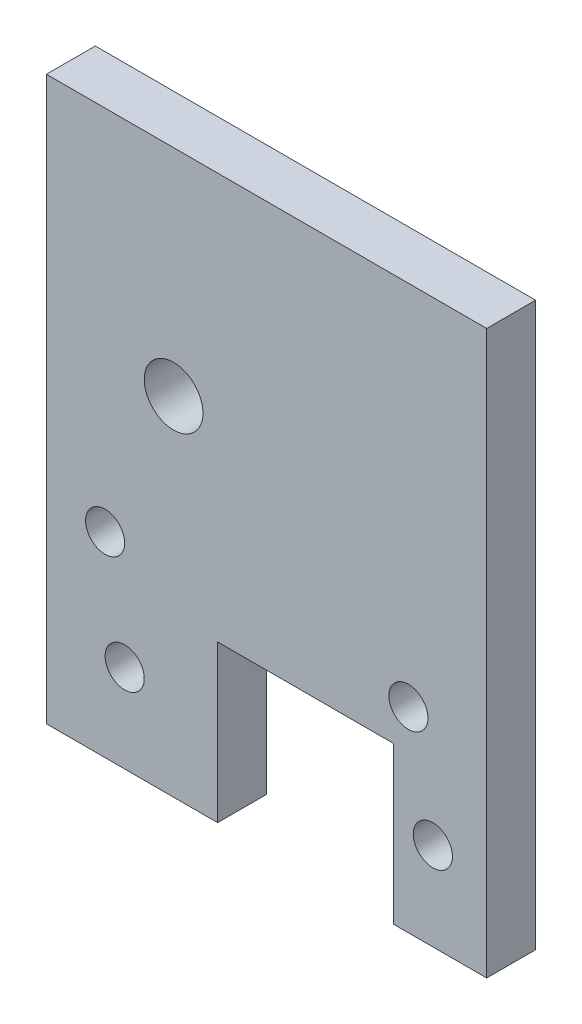
from build123d import *

# Parameters (mm, degrees)
SKETCH2_R           = 2
SKETCH2_R_2         = 3
BOSS_EXTRUDE1_DEPTH = 5


with BuildPart() as part:
    # Sketch2 → Boss-Extrude1 (new body)
    with BuildSketch(Plane.XY):
        Polygon((21, 30.75), (-24, 30.75), (-24, -26.75), (-6.5, -26.75), (-6.5, -10.75), (11.5, -10.75), (11.5, -26.75), (21, -26.75), align=None)
        with Locations((-16, -17.75)):
            Circle(SKETCH2_R, mode=Mode.SUBTRACT)
        with Locations((-18, -6.75)):
            Circle(SKETCH2_R, mode=Mode.SUBTRACT)
        with Locations((15.5, -17.75)):
            Circle(SKETCH2_R, mode=Mode.SUBTRACT)
        with Locations((13, -6.75)):
            Circle(SKETCH2_R, mode=Mode.SUBTRACT)
        with Locations((-11, 8.75)):
            Circle(SKETCH2_R_2, mode=Mode.SUBTRACT)
    extrude(amount=-BOSS_EXTRUDE1_DEPTH)


solid = part.part
